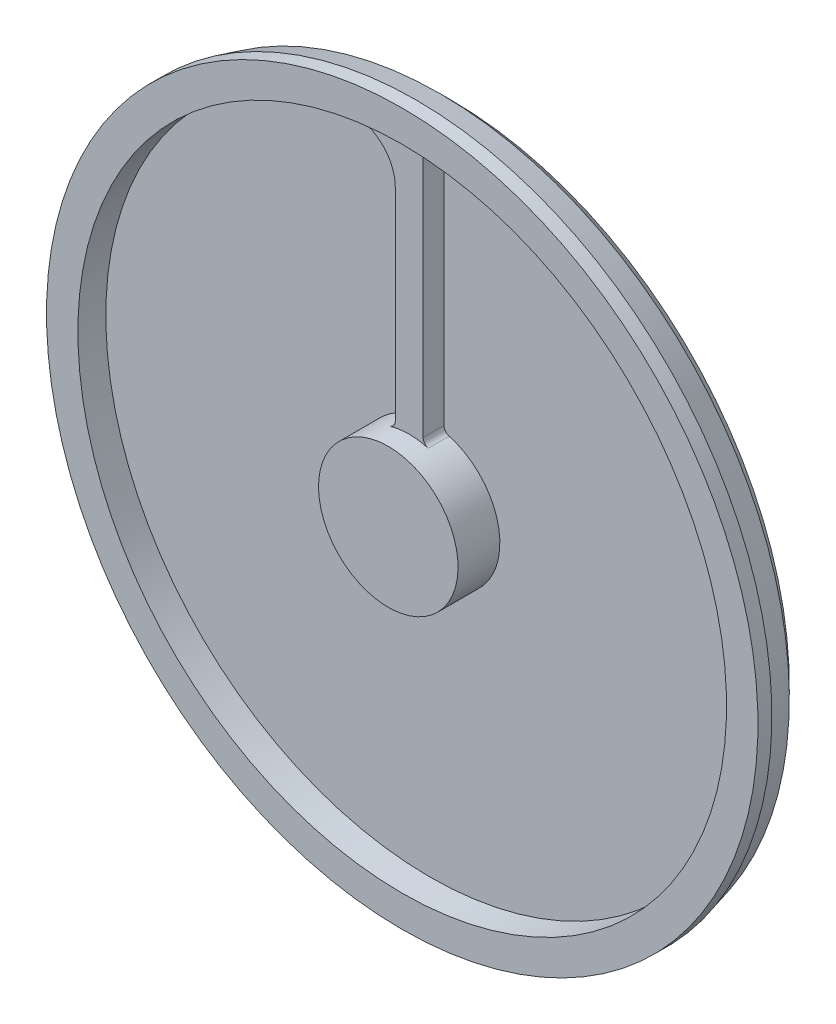
from build123d import *

# Parameters (mm, degrees)
BOSS_EXTRUDE1_DEPTH = 30
FILLET1_R           = 60
FILLET2_R           = 10


with BuildPart() as part:
    # Sketch1 → Revolve1 (revolve)
    with BuildSketch(Plane(origin=(0, 0, 0), x_dir=(0, 0, -1), z_dir=(1, 0, 0))):
        Polygon((0, 0), (0, 485), (-15.849364905, 500.849364905), (-50, 510), (-70, 510), (-70, 465), (-30, 465), (-30, 100), (-90, 100), (-90, 0), (-30, 0), align=None)
    revolve(axis=Axis((0, 0, 0), (0, 0, 1)))

    # Sketch2 → Boss-Extrude1 (add)
    with BuildSketch(Plane.XY.offset(30)):
        with BuildLine():
            Line((-20, 464.569693372), (-20, 97.979589711))
            ThreePointArc((-20, 97.979589711), (0, 100), (20, 97.979589711))
            Line((20, 97.979589711), (20, 464.569693372))
            ThreePointArc((20, 464.569693372), (0, 465), (-20, 464.569693372))
        make_face()
    extrude(amount=BOSS_EXTRUDE1_DEPTH)

    # Fillet1
    fillet1_edges = [part.edges().sort_by_distance(p)[0] for p in [
        (-20, 464.569693372, 45),
    ]]
    fillet(fillet1_edges, radius=FILLET1_R)

    # Fillet2
    fillet2_edges = [part.edges().sort_by_distance(p)[0] for p in [
        (20, 464.569693372, 45),
        (-20, 97.979589711, 45),
        (20, 97.979589711, 45),
    ]]
    fillet(fillet2_edges, radius=FILLET2_R)


solid = part.part
